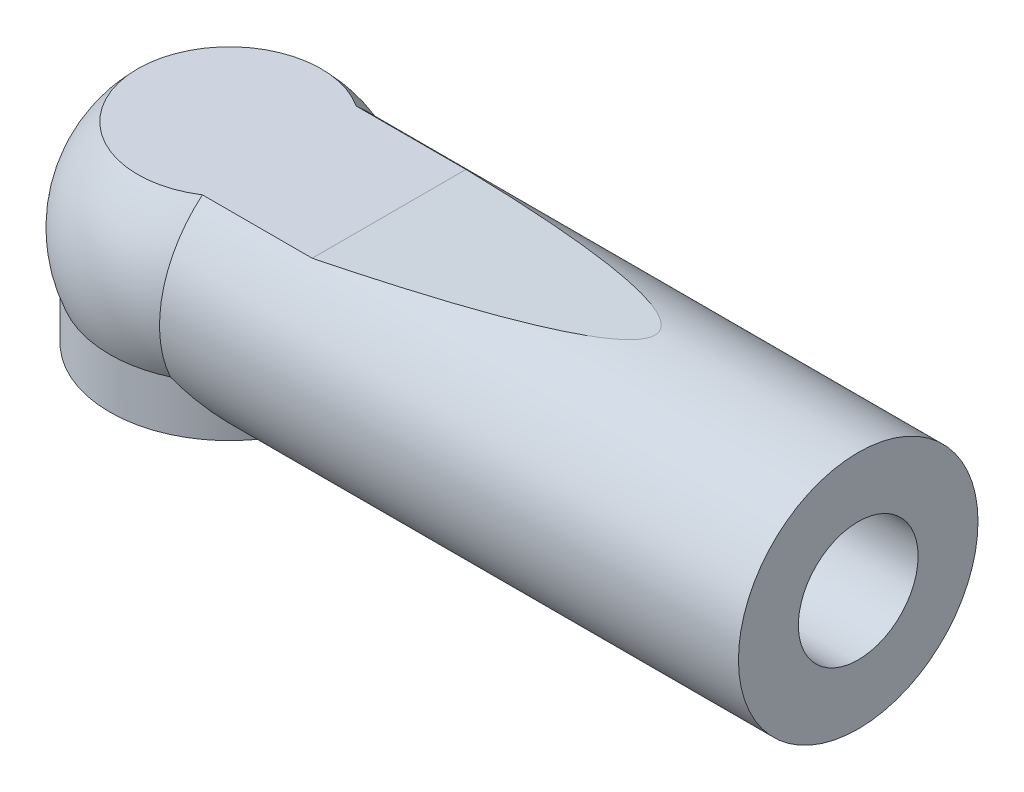
from build123d import *

# Parameters (mm, degrees)
ESQUISSE2_R             = 3
BOSS_EXTRU_1_DEPTH      = 15.75
ESQUISSE3_R             = 1.5
ENL_V_MAT_EXTRU_1_DEPTH = 12
ENL_V_MAT_EXTRU_2_DEPTH = 6
ESQUISSE5_R             = 3
BOSS_EXTRU_2_DEPTH      = 2.5


with BuildPart() as part:
    # Esquisse1 → Révolution1 (revolve)
    with BuildSketch(Plane.XY):
        with BuildLine():
            Line((0, 3.25), (0, -3.25))
            ThreePointArc((0, -3.25), (-3.25, 0), (0, 3.25))
        make_face()
    revolve(axis=Axis((0, 3.25, 0), (0, -1, 0)))

    # Esquisse2 → Boss.-Extru.1 (add)
    with BuildSketch(Plane(origin=(0, 0, 0), x_dir=(0, 0, -1), z_dir=(1, 0, 0))):
        with Locations(Location((0, 0, 0), (0, 0, 180))):
            Circle(ESQUISSE2_R)
    extrude(amount=BOSS_EXTRU_1_DEPTH)

    # Esquisse3 → Enlèv. mat.-Extru.1 (cut)
    with BuildSketch(Plane(origin=(15.75, 0, 0), x_dir=(0, 0, -1), z_dir=(1, 0, 0))):
        Circle(ESQUISSE3_R)
    extrude(amount=-ENL_V_MAT_EXTRU_1_DEPTH, mode=Mode.SUBTRACT)

    # Esquisse4 → Enlèv. mat.-Extru.2 (cut, symmetric)
    with BuildSketch(Plane.XY):
        Polygon((-2.296192501, 2.3), (4, 2.3), (13.038646232, 3.25), (-2.296192501, 3.25), align=None)
        Polygon((-2.296192501, -2.3), (4, -2.3), (7.545448267, -3.25), (-2.296192501, -3.25), align=None)
    extrude(amount=ENL_V_MAT_EXTRU_2_DEPTH, both=True, mode=Mode.SUBTRACT)

    # Esquisse5 → Boss.-Extru.2 (add)
    with BuildSketch(Plane(origin=(0, 0, 0), x_dir=(1, 0, 0), z_dir=(0, 1, 0))):
        with Locations(Location((0, 0, 0), (0, 0, 270))):
            Circle(ESQUISSE5_R)
    extrude(amount=-BOSS_EXTRU_2_DEPTH)

    # Esquisse6 → Enlèvement de matière-Révolution1 (revolve, cut)
    with BuildSketch(Plane.XY):
        with BuildLine():
            Line((1.75, -0.968245837), (1.75, -2.5))
            Line((1.75, -2.5), (0, -2.5))
            Line((0, -2.5), (0, 2))
            ThreePointArc((0, 2), (1.722859784, 1.015753003), (1.75, -0.968245837))
        make_face()
    revolve(axis=Axis((0, -2.5, 0), (0, 1, 0)), mode=Mode.SUBTRACT)


solid = part.part
